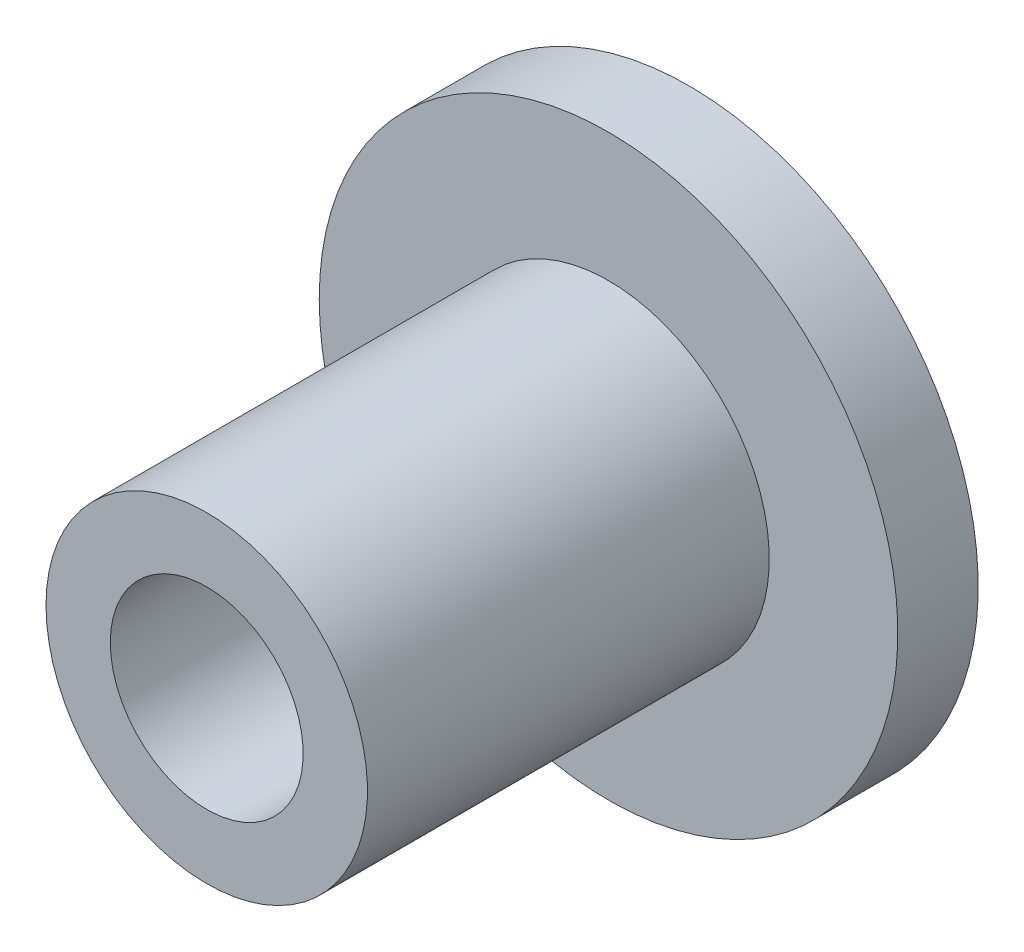
from build123d import *


with BuildPart() as part:
    # 草图1 → 旋转1 (revolve)
    with BuildSketch(Plane(origin=(0, 0, 0), x_dir=(1, 0, 0), z_dir=(0, 1, 0)), mode=Mode.PRIVATE) as revolve_1_sk:
        Polygon((6, 0), (18, 0), (18, -5), (10, -5), (10, -30), (6, -30), align=None)
    revolve(revolve_1_sk.sketch.rotate(Axis((0, 0, 0), (0, 0, 1)), 180), axis=Axis((0, 0, 0), (0, 0, 1)))


solid = part.part
